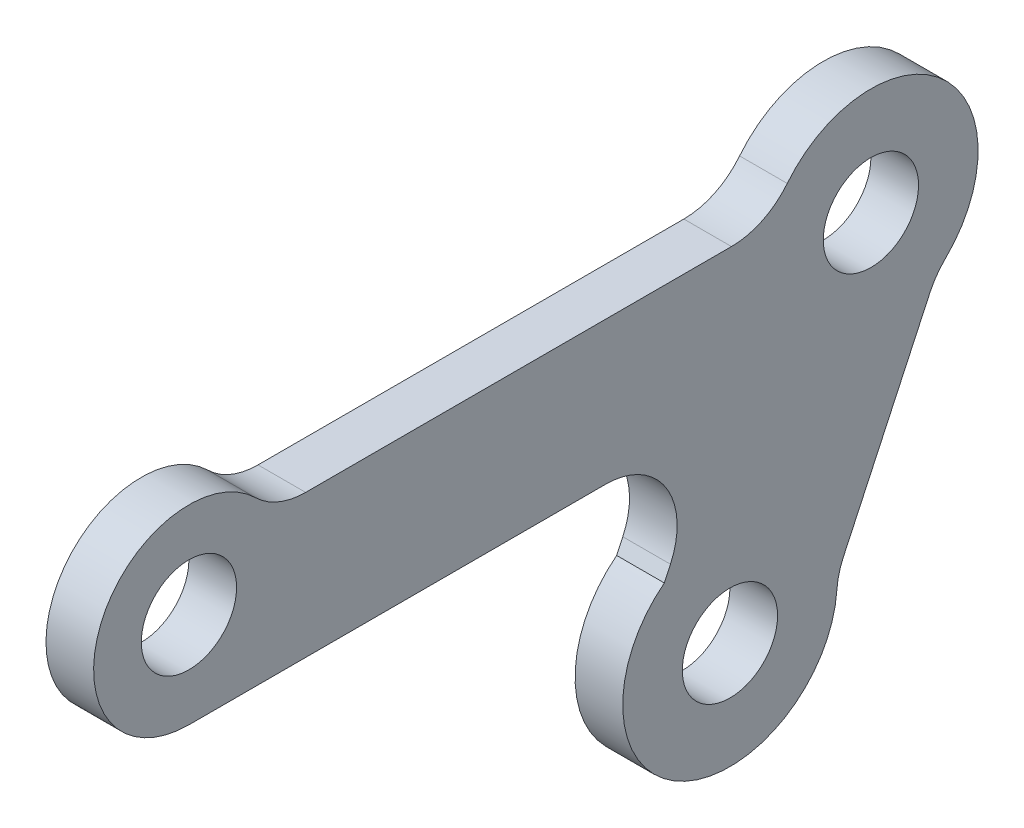
from build123d import *

# Parameters (mm, degrees)
EXTRUDE_1_DEPTH     = 2
SKETCH_1_3_R        = 2
CUT_EXTRUDE_1_DEPTH = 35.66133887
FILLET_1_R          = 3


with BuildPart() as part:
    # 草图1 → 凸台-拉伸1 (new body)
    with BuildSketch(Plane(origin=(0, 0, 0), x_dir=(0, 0, -1), z_dir=(1, 0, 0))):
        with BuildLine():
            Line((-25, -6), (-25, 0))
            Line((-25, 0), (-21.535898385, 0))
            ThreePointArc((-21.535898385, 0), (-28.464101615, 0), (-25, -6))
        make_face()
        with BuildLine():
            Line((-21.535898385, 0), (-25, 0))
            Line((-25, 0), (-25, -6))
            ThreePointArc((-25, -6), (-22.171572875, -4.828427125), (-21, -2))
            ThreePointArc((-21, -2), (-21.136296695, -0.96472382), (-21.535898385, 0))
        make_face()
        with BuildLine():
            Line((-0.545176611, 0), (-21.535898385, 0))
            ThreePointArc((-21.535898385, 0), (-21.136296695, -0.96472382), (-21, -2))
            ThreePointArc((-21, -2), (-22.171572875, -4.828427125), (-25, -6))
            Line((-25, -6), (-2.797845949, -6))
            Line((-2.797845949, -6), (-0.871249866, -1.868401368))
            ThreePointArc((-0.871249866, -1.868401368), (-0.807766841, -0.916826597), (-0.545176611, 0))
        make_face()
        with BuildLine():
            ThreePointArc((8.125231148, -1.690473047), (4.486383017, 2.726360373), (-0.545176611, 0))
            Line((-0.545176611, 0), (0, 0))
            Line((0, 0), (7.250462296, -3.380946094))
            Line((7.250462296, -3.380946094), (6.37921243, -5.249347462))
            ThreePointArc((6.37921243, -5.249347462), (7.66521356, -3.67252807), (8.125231148, -1.690473047))
        make_face()
        with BuildLine():
            Line((0, 0), (-0.545176611, 0))
            ThreePointArc((-0.545176611, 0), (-0.807766841, -0.916826597), (-0.871249866, -1.868401368))
            Line((-0.871249866, -1.868401368), (0, 0))
        make_face()
        with BuildLine():
            Line((-0.871249866, -1.868401368), (-2.797845949, -6))
            Line((-2.797845949, -6), (0, -6))
            Line((0, -6), (0, -4.356499889))
            ThreePointArc((0, -4.356499889), (-0.621910323, -3.177681615), (-0.871249866, -1.868401368))
        make_face()
        with BuildLine():
            Line((0, -6), (-2.797845949, -6))
            Line((-2.797845949, -6), (-5.045405798, -10.819907651))
            ThreePointArc((-5.045405798, -10.819907651), (-0.389642338, -10.300397024), (2.205056498, -14.200853745))
            Line((2.205056498, -14.200853745), (6.37921243, -5.249347462))
            ThreePointArc((6.37921243, -5.249347462), (3.001481776, -6.147034134), (0, -4.356499889))
            Line((0, -4.356499889), (0, -6))
        make_face()
        with BuildLine():
            Line((7.250462296, -3.380946094), (0, 0))
            Line((0, 0), (0, -4.356499889))
            ThreePointArc((0, -4.356499889), (3.001481776, -6.147034134), (6.37921243, -5.249347462))
            Line((6.37921243, -5.249347462), (7.250462296, -3.380946094))
        make_face()
        with BuildLine():
            Line((0, -4.356499889), (0, 0))
            Line((0, 0), (-0.871249866, -1.868401368))
            ThreePointArc((-0.871249866, -1.868401368), (-0.621910323, -3.177681615), (0, -4.356499889))
        make_face()
        with BuildLine():
            ThreePointArc((2.205056498, -14.200853745), (-0.389642338, -10.300397024), (-5.045405798, -10.819907651))
            Line((-5.045405798, -10.819907651), (-5.916655664, -12.688309019))
            Line((-5.916655664, -12.688309019), (1.333806632, -16.069255112))
            Line((1.333806632, -16.069255112), (2.205056498, -14.200853745))
        make_face()
        with BuildLine():
            Line((-5.916655664, -12.688309019), (-5.045405798, -10.819907651))
            ThreePointArc((-5.045405798, -10.819907651), (-4.27347954, -18.418764477), (2.208575484, -14.378782065))
            ThreePointArc((2.208575484, -14.378782065), (2.207695651, -14.289800508), (2.205056498, -14.200853745))
            Line((2.205056498, -14.200853745), (1.333806632, -16.069255112))
            Line((1.333806632, -16.069255112), (-5.916655664, -12.688309019))
        make_face()
    extrude(amount=EXTRUDE_1_DEPTH)

    # 草图1<3> → 切除-拉伸1 (cut, through all)
    with BuildSketch(Plane(origin=(0, 0, 0), x_dir=(0, 0, -1), z_dir=(1, 0, 0))):
        with Locations((-25, -2)):
            Circle(SKETCH_1_3_R)
        with Locations((3.625231148, -1.690473047)):
            Circle(SKETCH_1_3_R)
        with Locations((-2.291424516, -14.378782065)):
            Circle(SKETCH_1_3_R)
    extrude(amount=CUT_EXTRUDE_1_DEPTH, mode=Mode.SUBTRACT)

    # 圆角1
    fillet_1_edges = [part.edges().sort_by_distance(p)[0] for p in [
        (1, -14.200853745, -2.205056498),
        (1, -5.249347462, -6.37921243),
        (1, 0, 0.545176611),
        (1, 0, 21.535898385),
        (1, -6, 2.797845949),
    ]]
    fillet(fillet_1_edges, radius=FILLET_1_R)


solid = part.part
